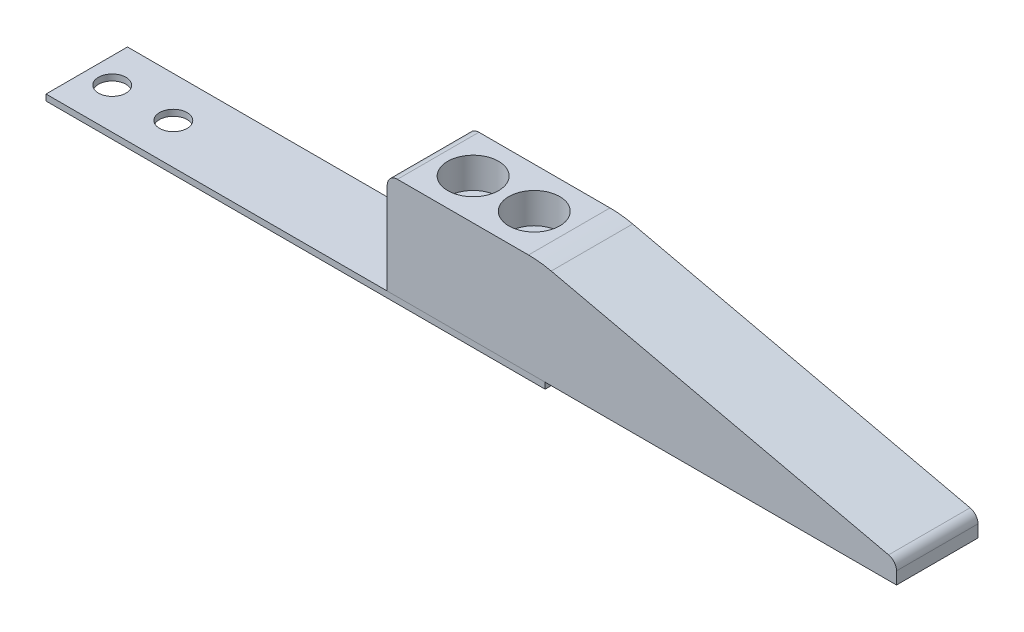
from build123d import *

# Parameters (mm, degrees)
SKETCH_1_W          = 49
SKETCH_1_H          = 8
SKETCH_1_R          = 1.35
EXTRUDE_1_DEPTH     = 0.6
EXTRUDE_2_DEPTH     = 8
FILLET_1_R          = 1
FILLET_2_R          = 10
FILLET_3_R          = 1
SKETCH_3_R          = 1.35
CUT_EXTRUDE_1_DEPTH = 85.549452985
SKETCH_4_R          = 2.5
CUT_EXTRUDE_2_DEPTH = 3


with BuildPart() as part:
    # 草图1 → 凸台-拉伸1 (new body)
    with BuildSketch(Plane(origin=(0, 0, 0), x_dir=(1, 0, 0), z_dir=(0, 1, 0))):
        with Locations((24.5, 4)):
            Rectangle(SKETCH_1_W, SKETCH_1_H)
        with Locations(Location((2.5, 4, 0), (0, 0, 270))):
            Circle(SKETCH_1_R, mode=Mode.SUBTRACT)
        with Locations(Location((8.5, 4, 0), (0, 0, 270))):
            Circle(SKETCH_1_R, mode=Mode.SUBTRACT)
    extrude(amount=EXTRUDE_1_DEPTH)


with BuildPart() as body_2:
    # 草图2 → 凸台-拉伸2 (new body)
    with BuildSketch(Plane.XY):
        Polygon((33.5, 0.6), (33.5, 10.6), (48.5, 10.6), (83.5, 2.6), (83.5, 0.6), align=None)
    extrude(amount=-EXTRUDE_2_DEPTH)

    # 圆角1
    fillet_1_edges = [body_2.edges().sort_by_distance(p)[0] for p in [
        (83.5, 2.6, -4),
    ]]
    fillet(fillet_1_edges, radius=FILLET_1_R)

    # 圆角2
    fillet_2_edges = [body_2.edges().sort_by_distance(p)[0] for p in [
        (48.5, 10.6, -4),
    ]]
    fillet(fillet_2_edges, radius=FILLET_2_R)

    # 圆角3
    fillet_3_edges = [body_2.edges().sort_by_distance(p)[0] for p in [
        (33.5, 10.6, -4),
    ]]
    fillet(fillet_3_edges, radius=FILLET_3_R)


with BuildPart() as cut_extrude_1_tool:
    # 草图3 → 切除-拉伸1 (new, through all)
    with BuildSketch(Plane(origin=(0, 10.6, 0), x_dir=(1, 0, 0), z_dir=(0, 1, 0))):
        with Locations(Location((37.935846161, 4, 0), (0, 0, 270))):
            Circle(SKETCH_3_R)
        with Locations(Location((43.935846161, 4, 0), (0, 0, 90))):
            Circle(SKETCH_3_R)
    extrude(amount=-CUT_EXTRUDE_1_DEPTH)


with BuildPart() as part_1:
    add(part.part)

    # 切除-拉伸1: cut by cut_extrude_1_tool
    add(cut_extrude_1_tool.part, mode=Mode.SUBTRACT)


with BuildPart() as body_2_1:
    add(body_2.part)

    # 切除-拉伸1: cut by cut_extrude_1_tool
    add(cut_extrude_1_tool.part, mode=Mode.SUBTRACT)

    # 草图4 → 切除-拉伸2 (cut)
    with BuildSketch(Plane(origin=(0, 10.6, 0), x_dir=(1, 0, 0), z_dir=(0, 1, 0))):
        with Locations(Location((37.935846161, 4, 0), (0, 0, 270))):
            Circle(SKETCH_4_R)
        with Locations(Location((43.935846161, 4, 0), (0, 0, 270))):
            Circle(SKETCH_4_R)
    extrude(amount=-CUT_EXTRUDE_2_DEPTH, mode=Mode.SUBTRACT)


solid = Compound([part_1.part, body_2_1.part])
